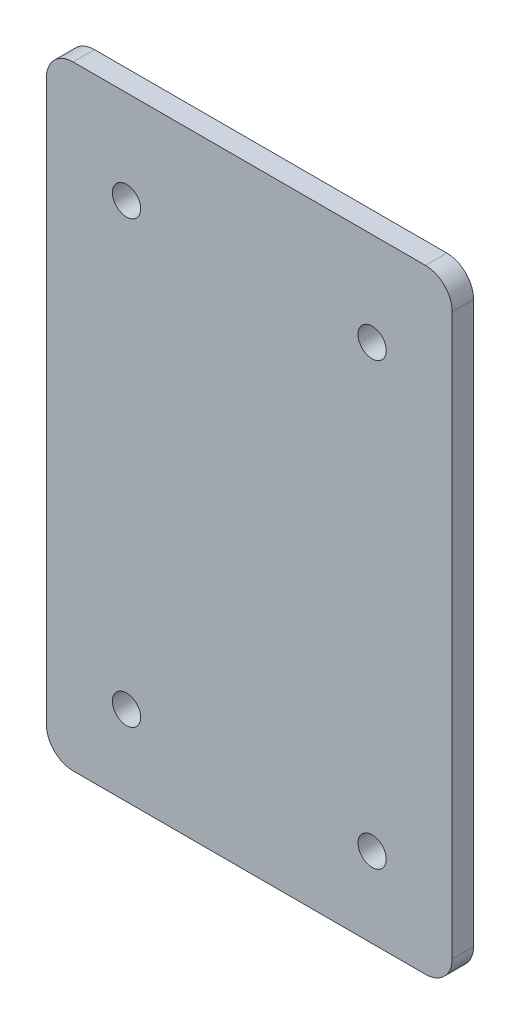
from build123d import *

# Parameters (mm, degrees)
SKETCH1_W            = 76
SKETCH1_H            = 115
BOSS_EXTRUDE1_DEPTH  = 4
M5_CLEARANCE_HOLE1_D = 5.3
FILLET1_R            = 5


with BuildPart() as part:
    # Sketch1 → Boss-Extrude1 (new body)
    with BuildSketch(Plane.XY):
        with Locations((0, 27.5)):
            Rectangle(SKETCH1_W, SKETCH1_H)
    extrude(amount=BOSS_EXTRUDE1_DEPTH)

    # M5 Clearance Hole1 (through all)
    with Locations(Plane.XY.offset(4)):
        with Locations((-23, 67.5), (-23, -15), (23, -15), (23, 67.5)):
            Hole(M5_CLEARANCE_HOLE1_D / 2)

    # Fillet1
    fillet1_edges = [part.edges().sort_by_distance(p)[0] for p in [
        (-38, 85, 2),
        (38, 85, 2),
        (38, -30, 2),
        (-38, -30, 2),
    ]]
    fillet(fillet1_edges, radius=FILLET1_R)


solid = part.part
